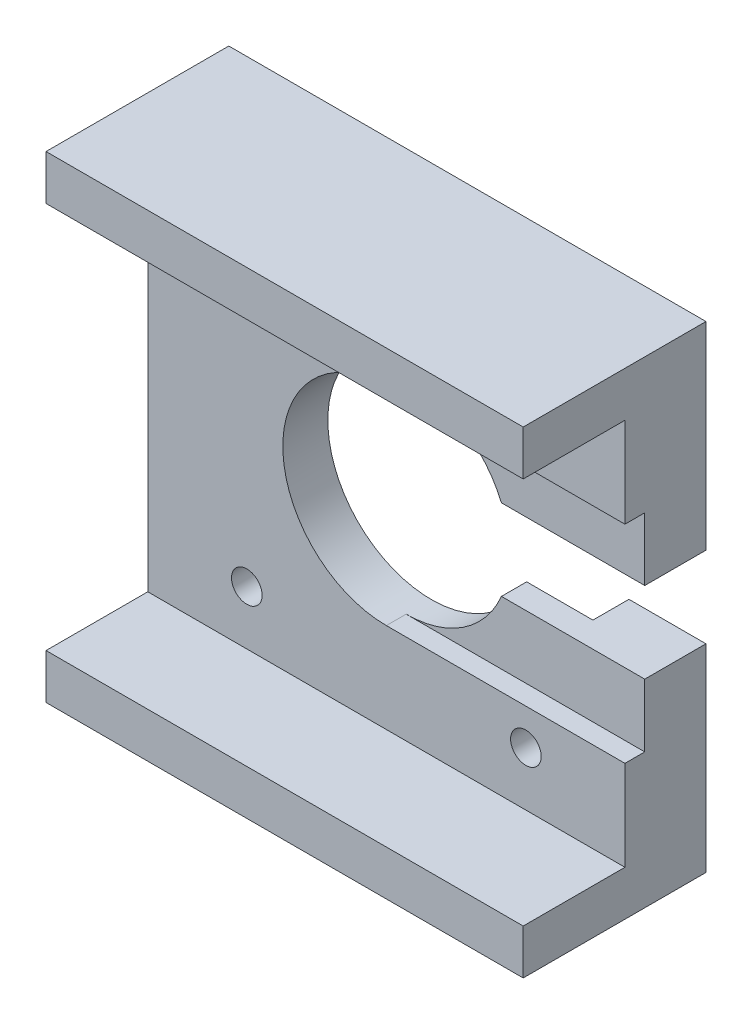
from build123d import *

# Parameters (mm, degrees)
SKETCH1_W           = 53
SKETCH1_H           = 53
BOSS_EXTRUDE1_DEPTH = 5
BOSS_EXTRUDE2_DEPTH = 11.3
CUT_EXTRUDE1_DEPTH  = 40.143198643
CUT_EXTRUDE2_DEPTH  = 2.2
SKETCH5_R           = 1.7
CUT_EXTRUDE3_DEPTH  = 41.867958109
CIRPATTERN1_COUNT   = 4
BOSS_EXTRUDE3_START = 4
SKETCH6_R           = 1.7
BOSS_EXTRUDE3_DEPTH = 4
SKETCH7_R           = 2.95
CUT_EXTRUDE4_DEPTH  = 0.5


with BuildPart() as part:
    # Sketch1 → Boss-Extrude1 (new body)
    with BuildSketch(Plane.XY):
        Rectangle(SKETCH1_W, SKETCH1_H)
    extrude(amount=BOSS_EXTRUDE1_DEPTH)

    # Sketch2 → Boss-Extrude2 (add)
    with BuildSketch(Plane.XY.offset(5)):
        Polygon((-26.5, 21.5), (-21.5, 21.5), (21.5, 21.5), (26.5, 21.5), (26.5, 26.5), (-26.5, 26.5), align=None)
        Polygon((21.5, -21.5), (-21.5, -21.5), (-26.5, -21.5), (-26.5, -26.5), (26.5, -26.5), (26.5, -21.5), align=None)
    extrude(amount=BOSS_EXTRUDE2_DEPTH)

    # Sketch4 → Cut-Extrude1 (cut, through all)
    with BuildSketch(Plane.XY.offset(5)):
        with BuildLine():
            Line((26.5, 4.5), (10.583005244, 4.5))
            ThreePointArc((10.583005244, 4.5), (11.268419594, 2.296240372), (11.5, 0))
            ThreePointArc((11.5, 0), (11.268419594, -2.296240372), (10.583005244, -4.5))
            Line((10.583005244, -4.5), (26.5, -4.5))
            Line((26.5, -4.5), (26.5, 4.5))
        make_face()
        with BuildLine():
            Line((5.5, -4.5), (5.5, 4.5))
            Line((5.5, 4.5), (10.583005244, 4.5))
            ThreePointArc((10.583005244, 4.5), (-11.5, 0), (10.583005244, -4.5))
            Line((10.583005244, -4.5), (5.5, -4.5))
        make_face()
        with BuildLine():
            Line((10.583005244, 4.5), (5.5, 4.5))
            Line((5.5, 4.5), (5.5, -4.5))
            Line((5.5, -4.5), (10.583005244, -4.5))
            ThreePointArc((10.583005244, -4.5), (11.268419594, -2.296240372), (11.5, 0))
            ThreePointArc((11.5, 0), (11.268419594, 2.296240372), (10.583005244, 4.5))
        make_face()
    extrude(amount=-CUT_EXTRUDE1_DEPTH, mode=Mode.SUBTRACT)

    # Sketch3 → Cut-Extrude2 (cut)
    with BuildSketch(Plane.XY.offset(5)):
        with BuildLine():
            Line((26.5, 11.5), (2.1e-08, 11.5))
            ThreePointArc((2.1e-08, 11.5), (6.344288779, 9.591663041), (10.583005244, 4.5))
            Line((10.583005244, 4.5), (26.5, 4.5))
            Line((26.5, 4.5), (26.5, 11.5))
        make_face()
        with BuildLine():
            ThreePointArc((10.583005244, -4.5), (6.344288761, -9.591663053), (-2.3e-08, -11.5))
            Line((-2.3e-08, -11.5), (26.5, -11.5))
            Line((26.5, -11.5), (26.5, -4.5))
            Line((26.5, -4.5), (10.583005244, -4.5))
        make_face()
    extrude(amount=-CUT_EXTRUDE2_DEPTH, mode=Mode.SUBTRACT)

    # Sketch5 → Cut-Extrude3 (cut, through all)
    with BuildSketch(Plane(origin=(0, 0, 0), x_dir=(-1, 0, 0), z_dir=(0, 0, -1))):
        with Locations((-15.5, 15.5)):
            Circle(SKETCH5_R)
    cut_extrude3 = extrude(amount=-CUT_EXTRUDE3_DEPTH, mode=Mode.SUBTRACT)

    # CirPattern1: Cut-Extrude3 ×4 about axis
    cirpattern1_axis = Axis((0, 0, 0), (0, 0, 1))
    for i in range(1, CIRPATTERN1_COUNT):
        add(cut_extrude3.rotate(cirpattern1_axis, i * 360 / CIRPATTERN1_COUNT), mode=Mode.SUBTRACT)

    # Sketch6 → Boss-Extrude3 (add)
    with BuildSketch(Plane(origin=(0, 0, 0), x_dir=(-1, 0, 0), z_dir=(0, 0, -1)).offset(BOSS_EXTRUDE3_START)):
        with BuildLine():
            Line((-26.5, 26.5), (-26.5, 4.5))
            Line((-26.5, 4.5), (-17.944358445, 4.5))
            ThreePointArc((-17.944358445, 4.5), (2.267087203, 18.360564142), (18.5, 0))
            ThreePointArc((18.5, 0), (2.267087203, -18.360564142), (-17.944358445, -4.5))
            Line((-17.944358445, -4.5), (-26.5, -4.5))
            Line((-26.5, -4.5), (-26.5, -26.5))
            Line((-26.5, -26.5), (26.5, -26.5))
            Line((26.5, -26.5), (26.5, 26.5))
            Line((26.5, 26.5), (-26.5, 26.5))
        make_face()
        with Locations((-15.5, -15.5)):
            Circle(SKETCH6_R, mode=Mode.SUBTRACT)
        with Locations((15.5, -15.5)):
            Circle(SKETCH6_R, mode=Mode.SUBTRACT)
        with Locations((-15.5, 15.5)):
            Circle(SKETCH6_R, mode=Mode.SUBTRACT)
        with Locations((15.5, 15.5)):
            Circle(SKETCH6_R, mode=Mode.SUBTRACT)
    extrude(amount=-BOSS_EXTRUDE3_DEPTH)

    # Sketch7 → Cut-Extrude4 (cut)
    with BuildSketch(Plane(origin=(0, 0, -4), x_dir=(-1, 0, 0), z_dir=(0, 0, -1))):
        with Locations((-15.5, 15.5)):
            Circle(SKETCH7_R)
        with Locations((15.5, 15.5)):
            Circle(SKETCH7_R)
        with Locations((15.5, -15.5)):
            Circle(SKETCH7_R)
        with Locations((-15.5, -15.5)):
            Circle(SKETCH7_R)
    extrude(amount=-CUT_EXTRUDE4_DEPTH, mode=Mode.SUBTRACT)


solid = part.part
